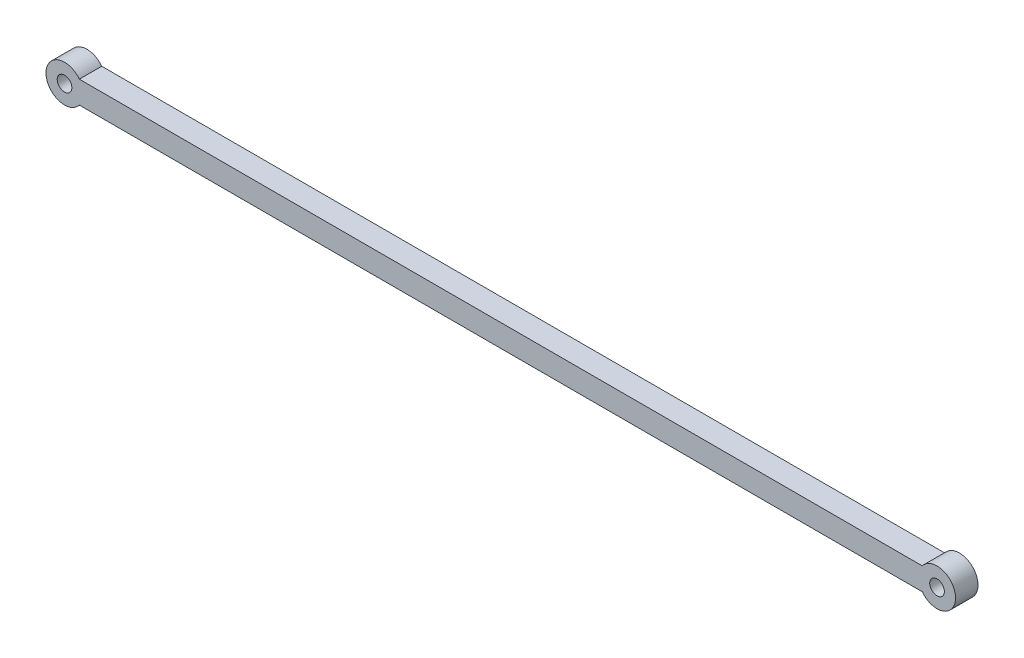
from build123d import *

# Parameters (mm, degrees)
SKETCH3_R           = 18.15695
SKETCH3_W           = 825.4731278
SKETCH3_H           = 21.9525
BOSS_EXTRUDE1_DEPTH = 10.97625
SKETCH4_R           = 7.1807
CUT_EXTRUDE1_DEPTH  = 645.139348927


with BuildPart() as part:
    # Sketch3 → Boss-Extrude1 (new, symmetric)
    with BuildSketch(Plane.XY):
        with Locations((-625.352112676, 0)):
            Circle(SKETCH3_R)
        with Locations((229.048287324, 0)):
            Circle(SKETCH3_R)
        with Locations((-198.151912676, 0)):
            Rectangle(SKETCH3_W, SKETCH3_H)
    extrude(amount=BOSS_EXTRUDE1_DEPTH, both=True)

    # Sketch4 → Cut-Extrude1 (cut, through all)
    with BuildSketch(Plane.XY.offset(10.97625)):
        with Locations((-625.352112676, 0)):
            Circle(SKETCH4_R)
        with Locations((229.048287324, 0)):
            Circle(SKETCH4_R)
    extrude(amount=-CUT_EXTRUDE1_DEPTH, mode=Mode.SUBTRACT)


solid = part.part
